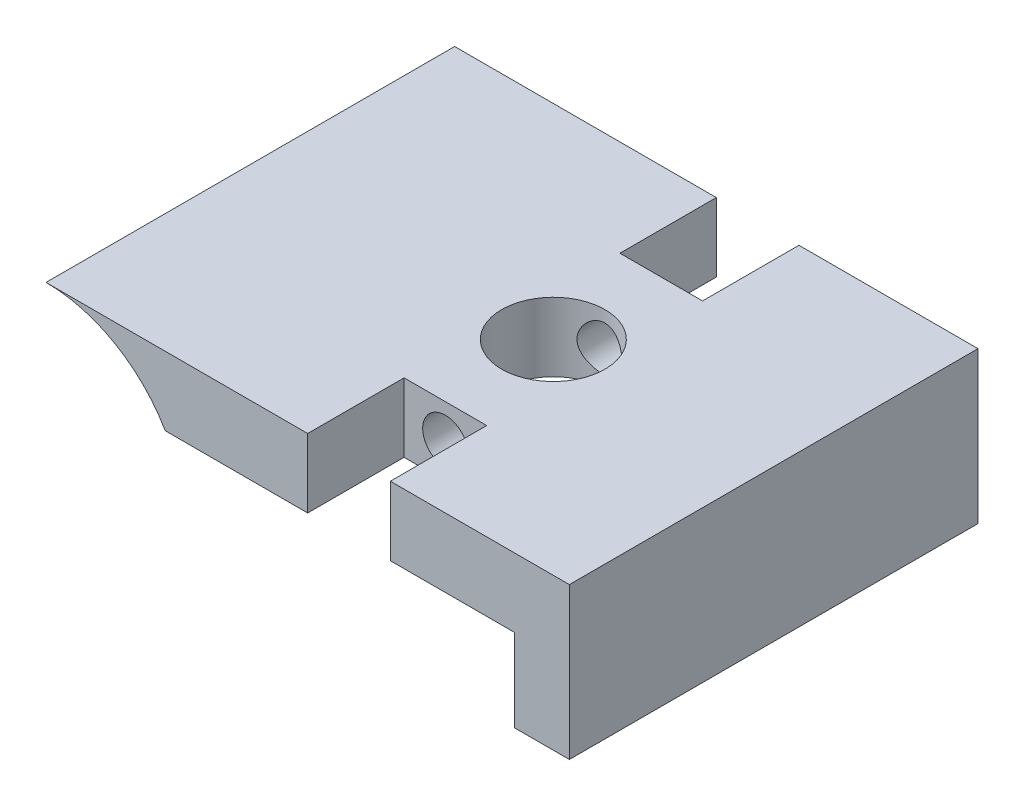
from build123d import *

# Parameters (mm, degrees)
BOSS_EXTRUDE1_DEPTH = 14.835
CUT_EXTRUDE1_REACH  = 37.321
SKETCH4_R           = 1.65
SKETCH4_3_W         = 6
SKETCH4_3_H         = 5
SKETCH4_3_R         = 1.65
CUT_EXTRUDE3_DEPTH  = 7
CUT_EXTRUDE2_REACH  = 26.619
SKETCH5_R           = 3.75
SKETCH6_W           = 4
SKETCH6_H           = 6
BOSS_EXTRUDE2_DEPTH = 29.67


with BuildPart() as part:
    # Sketch3 → Boss-Extrude1 (new, symmetric)
    with BuildSketch(Plane.XY):
        with BuildLine():
            Line((-10.339745962, -2.5), (19, -2.5))
            Line((19, -2.5), (19, 2.5))
            Line((19, 2.5), (-19, 2.5))
            ThreePointArc((-19, 2.5), (-14, 1.160254038), (-10.339745962, -2.5))
        make_face()
    extrude(amount=BOSS_EXTRUDE1_DEPTH, both=True)

    # Sketch4 → Cut-Extrude1 (cut, up to next)
    with BuildSketch(Plane.XY.offset(14.835), mode=Mode.PRIVATE) as cut_extrude1_sk1:
        with Locations((3, 0)):
            Circle(SKETCH4_R)
    cut_extrude1_tool1 = extrude(cut_extrude1_sk1.sketch, amount=-CUT_EXTRUDE1_REACH, mode=Mode.PRIVATE) & part.part
    add(cut_extrude1_tool1.solids().sort_by_distance((3, 0, 14.835))[0], mode=Mode.SUBTRACT)

    # Sketch4<3> → Cut-Extrude3 (cut)
    with BuildSketch(Plane.XY.offset(14.835)):
        with Locations((3, 0)):
            Rectangle(SKETCH4_3_W, SKETCH4_3_H)
        with Locations((3, 0)):
            Circle(SKETCH4_3_R, mode=Mode.SUBTRACT)
    cut_extrude3 = extrude(amount=-CUT_EXTRUDE3_DEPTH, mode=Mode.SUBTRACT)

    # Mirror1: Cut-Extrude3 across plane
    add(cut_extrude3.mirror(Plane.XY), mode=Mode.SUBTRACT)

    # Sketch5 → Cut-Extrude2 (cut, up to next)
    with BuildSketch(Plane(origin=(0, 2.5, 0), x_dir=(1, 0, 0), z_dir=(0, 1, 0)), mode=Mode.PRIVATE) as cut_extrude2_sk1:
        with Locations(Location((3, 0, 0), (0, 0, 270))):
            Circle(SKETCH5_R)
    cut_extrude2_tool1 = extrude(cut_extrude2_sk1.sketch, amount=-CUT_EXTRUDE2_REACH, mode=Mode.PRIVATE) & part.part
    add(cut_extrude2_tool1.solids().sort_by_distance((3, 2.5, 0))[0], mode=Mode.SUBTRACT)

    # Sketch6 → Boss-Extrude2 (add)
    with BuildSketch(Plane.XY.offset(14.835)):
        with Locations((17, -5.5)):
            Rectangle(SKETCH6_W, SKETCH6_H)
    extrude(amount=-BOSS_EXTRUDE2_DEPTH)


solid = part.part
